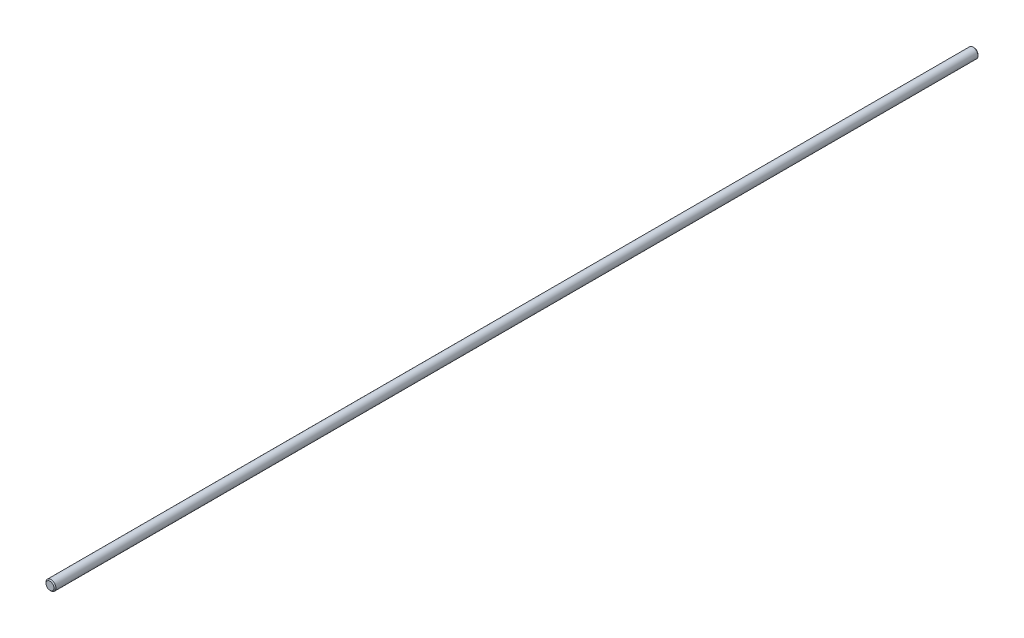
from build123d import *

# Parameters (mm, degrees)
SKETCH1_R           = 2.495
BOSS_EXTRUDE1_DEPTH = 464
CHAMFER1_SIZE       = 0.5


with BuildPart() as part:
    # Sketch1 → Boss-Extrude1 (new body)
    with BuildSketch(Plane.XY):
        with Locations(Location((0, 0, 0), (0, 0, 180))):
            Circle(SKETCH1_R)
    extrude(amount=BOSS_EXTRUDE1_DEPTH)

    # Chamfer1
    chamfer1_edges = [part.edges().sort_by_distance(p)[0] for p in [
        (2.495, 0, 0),
        (2.495, 0, 464),
    ]]
    chamfer(chamfer1_edges, length=CHAMFER1_SIZE)


solid = part.part
